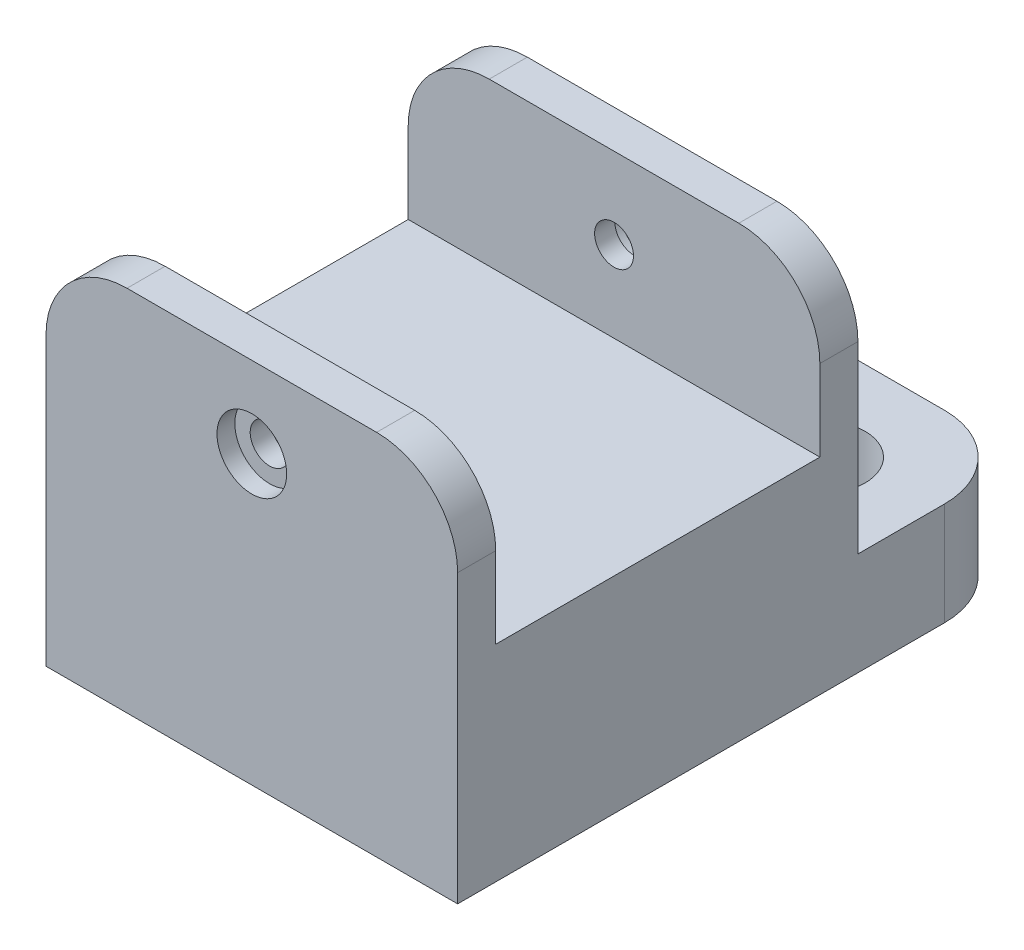
from build123d import *

# Parameters (mm, degrees)
SKETCH1_W                                        = 50.8
SKETCH1_H                                        = 25.4
BOSS_EXTRUDE1_DEPTH                              = 25.4
CBORE_FOR_1_4_SOCKET_HEAD_CAP_SCREW1_D           = 6.7564
CBORE_FOR_1_4_SOCKET_HEAD_CAP_SCREW1_CBORE_D     = 11.1125
CBORE_FOR_1_4_SOCKET_HEAD_CAP_SCREW1_CBORE_DEPTH = 19.05
SKETCH6_W                                        = 50.8
SKETCH6_H                                        = 4.7
BOSS_EXTRUDE2_DEPTH                              = 20
CBORE_FOR_M4_SBHCS1_D                            = 4.8
CBORE_FOR_M4_SBHCS1_CBORE_D                      = 8.6
CBORE_FOR_M4_SBHCS1_CBORE_DEPTH                  = 2.2
FILLET1_R                                        = 10
SKETCH15_W                                       = 50.8
SKETCH15_H                                       = 25.4
BOSS_EXTRUDE3_DEPTH                              = 20
SKETCH16_W                                       = 51.113320751
SKETCH16_H                                       = 27.993322013
CUT_EXTRUDE2_DEPTH                               = 12.7
SKETCH17_W                                       = 50.8
SKETCH17_H                                       = 12.7
CUT_EXTRUDE3_DEPTH                               = 20.7


with BuildPart() as part:
    # Sketch1 → Boss-Extrude1 (new body)
    with BuildSketch(Plane(origin=(0, 0, 0), x_dir=(1, 0, 0), z_dir=(0, 1, 0))):
        with Locations((2.315568022, 7.890743338)):
            Rectangle(SKETCH1_W, SKETCH1_H)
    extrude(amount=BOSS_EXTRUDE1_DEPTH)

    # CBORE for 1/4 Socket Head Cap Screw1 (through all)
    with Locations(Plane(origin=(0, 25.4, 0), x_dir=(1, 0, 0), z_dir=(0, 1, 0))):
        with Locations((-10.384431978, 7.890743338), (15.015568022, 7.890743338)):
            CounterBoreHole(CBORE_FOR_1_4_SOCKET_HEAD_CAP_SCREW1_D / 2, CBORE_FOR_1_4_SOCKET_HEAD_CAP_SCREW1_CBORE_D / 2, CBORE_FOR_1_4_SOCKET_HEAD_CAP_SCREW1_CBORE_DEPTH)

    # Sketch6 → Boss-Extrude2 (add)
    with BuildSketch(Plane(origin=(0, 25.4, 0), x_dir=(1, 0, 0), z_dir=(0, 1, 0))):
        with Locations((2.315568022, 18.240743338)):
            Rectangle(SKETCH6_W, SKETCH6_H)
    extrude(amount=BOSS_EXTRUDE2_DEPTH)

    # CBORE for M4 SBHCS1 (through all)
    with Locations(Plane.XY.offset(-15.890743338)):
        with Locations((2.315568022, 35.4)):
            CounterBoreHole(CBORE_FOR_M4_SBHCS1_D / 2, CBORE_FOR_M4_SBHCS1_CBORE_D / 2, CBORE_FOR_M4_SBHCS1_CBORE_DEPTH)

    # Fillet1
    fillet1_edges = [part.edges().sort_by_distance(p)[0] for p in [
        (27.715568022, 45.4, -18.240743338),
        (-23.084431978, 45.4, -18.240743338),
        (27.715568022, 12.7, 4.809256662),
        (-23.084431978, 12.7, 4.809256662),
    ]]
    fillet(fillet1_edges, radius=FILLET1_R)

    # Sketch15 → Boss-Extrude3 (add)
    with BuildSketch(Plane(origin=(0, 0, -20.590743338), x_dir=(-1, 0, 0), z_dir=(0, 0, -1))):
        with Locations((-2.315568022, 12.7)):
            Rectangle(SKETCH15_W, SKETCH15_H)
    extrude(amount=BOSS_EXTRUDE3_DEPTH)

    # Sketch16 → Cut-Extrude2 (cut)
    with BuildSketch(Plane(origin=(0, 25.4, 0), x_dir=(1, 0, 0), z_dir=(0, 1, 0))):
        with Locations((2.472228398, 1.894082332)):
            Rectangle(SKETCH16_W, SKETCH16_H)
    extrude(amount=-CUT_EXTRUDE2_DEPTH, mode=Mode.SUBTRACT)

    # Mirror1: part across plane


with BuildPart() as part_1:
    add(part.part)
    add(part.part.mirror(Plane(origin=(0, 0, -40.590743338), x_dir=(1, 0, 0), z_dir=(0, 0, -1))))

    # Sketch17 → Cut-Extrude3 (cut)
    with BuildSketch(Plane.XY.offset(4.809256662)):
        with Locations((2.315568022, 6.35)):
            Rectangle(SKETCH17_W, SKETCH17_H)
    extrude(amount=-CUT_EXTRUDE3_DEPTH, mode=Mode.SUBTRACT)


solid = part_1.part
